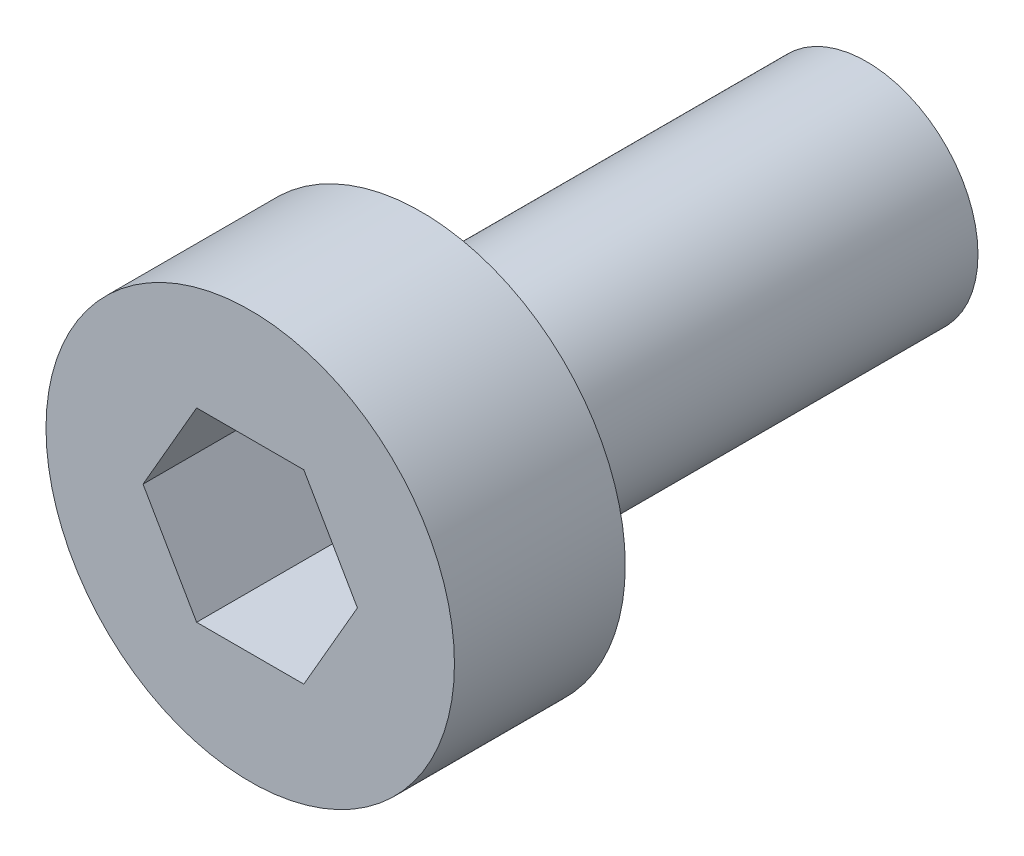
from build123d import *

# Parameters (mm, degrees)
ESQUISSE1_R             = 1.5
BOSS_EXTRU_1_DEPTH      = 6
ESQUISSE2_R             = 2.75
BOSS_EXTRU_2_DEPTH      = 2.3
ENL_V_MAT_EXTRU_1_DEPTH = 2


with BuildPart() as part:
    # Esquisse1 → Boss.-Extru.1 (new body)
    with BuildSketch(Plane.XY):
        Circle(ESQUISSE1_R)
    extrude(amount=BOSS_EXTRU_1_DEPTH)

    # Esquisse2 → Boss.-Extru.2 (add)
    with BuildSketch(Plane.XY.offset(6)):
        Circle(ESQUISSE2_R)
    extrude(amount=BOSS_EXTRU_2_DEPTH)

    # Esquisse3 → Enlèv. mat.-Extru.1 (cut)
    with BuildSketch(Plane.XY.offset(8.3)):
        Polygon((1.443375673, 0), (0.721687836, 1.25), (-0.721687836, 1.25), (-1.443375673, 0), (-0.721687836, -1.25), (0.721687836, -1.25), align=None)
    extrude(amount=-ENL_V_MAT_EXTRU_1_DEPTH, mode=Mode.SUBTRACT)


solid = part.part
